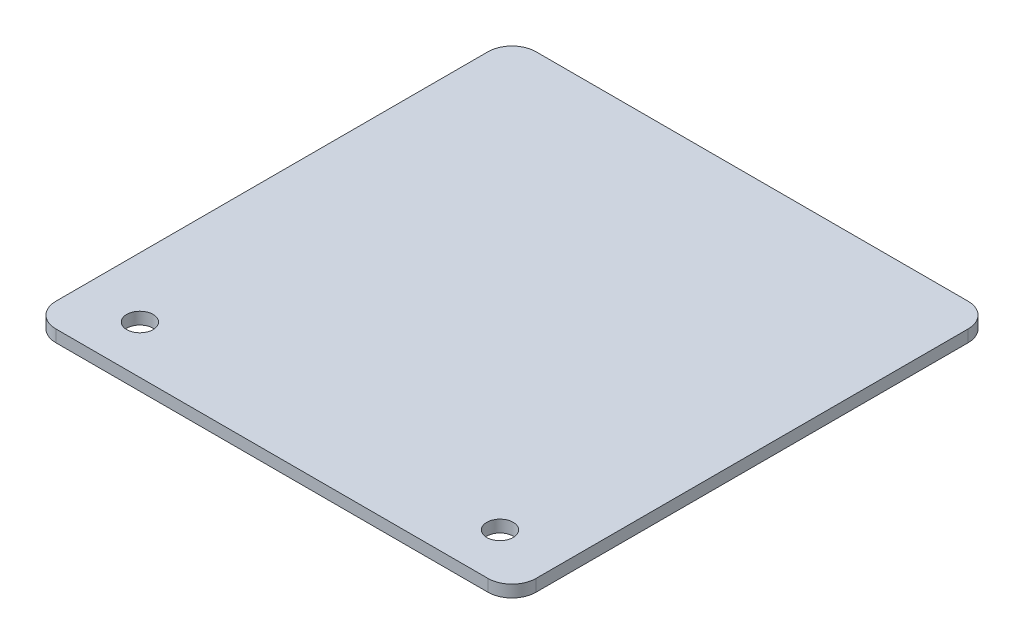
from build123d import *

# Parameters (mm, degrees)
SKETCH1_W                = 100
SKETCH1_H                = 100
BOSS_EXTRUDE1_DEPTH      = 2.5
M5_CLEARANCE_HOLE1_D     = 5.5
M5_CLEARANCE_HOLE1_DEPTH = 12
M5_CLEARANCE_HOLE1_TIP   = 1.652366702
FILLET1_R                = 5


with BuildPart() as part:
    # Sketch1 → Boss-Extrude1 (new body)
    with BuildSketch(Plane(origin=(0, 0, 0), x_dir=(1, 0, 0), z_dir=(0, 1, 0))):
        Rectangle(SKETCH1_W, SKETCH1_H)
    extrude(amount=BOSS_EXTRUDE1_DEPTH)

    # M5 Clearance Hole1
    with Locations(Plane(origin=(0, 2.5, 0), x_dir=(1, 0, 0), z_dir=(0, 1, 0))):
        with Locations((-37.5, -40), (37.5, -40)):
            Hole(M5_CLEARANCE_HOLE1_D / 2, depth=M5_CLEARANCE_HOLE1_DEPTH)
            with Locations((0, 0, -(M5_CLEARANCE_HOLE1_DEPTH + M5_CLEARANCE_HOLE1_TIP / 2))):  # 118° drill point
                Cone(0, M5_CLEARANCE_HOLE1_D / 2, M5_CLEARANCE_HOLE1_TIP, mode=Mode.SUBTRACT)

    # Fillet1
    fillet1_edges = [part.edges().sort_by_distance(p)[0] for p in [
        (50, 1.25, 50),
        (-50, 1.25, 50),
        (-50, 1.25, -50),
        (50, 1.25, -50),
    ]]
    fillet(fillet1_edges, radius=FILLET1_R)


solid = part.part
